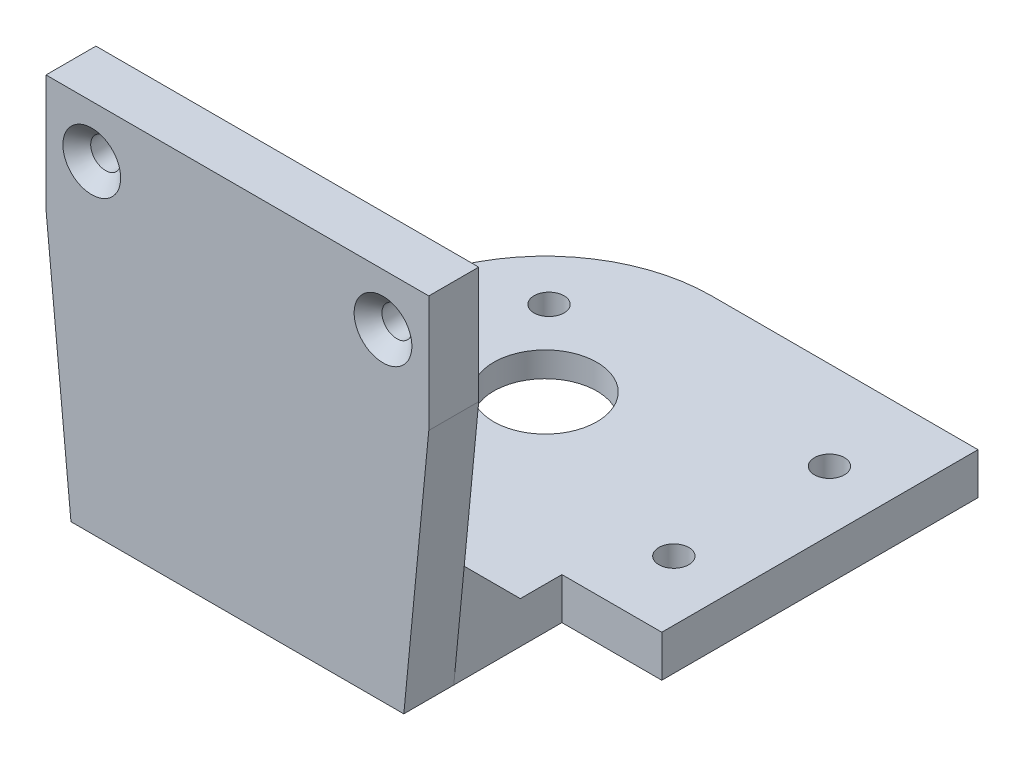
from build123d import *

# Parameters (mm, degrees)
SKETCH1_R                                            = 18
SKETCH1_R_2                                          = 6.2
BOSS_EXTRUDE1_DEPTH                                  = 3
BOSS_EXTRUDE2_START                                  = -5
SKETCH5_R                                            = 20
SKETCH5_R_2                                          = 18
BOSS_EXTRUDE2_DEPTH                                  = 5
BOSS_EXTRUDE3_START                                  = -5
BOSS_EXTRUDE3_DEPTH                                  = 5
SKETCH7_W                                            = 40
SKETCH7_H                                            = 45
BOSS_EXTRUDE4_DEPTH                                  = 6
SKETCH8_W                                            = 46
SKETCH8_H                                            = 14
BOSS_EXTRUDE5_DEPTH                                  = 6
BOSS_EXTRUDE6_DEPTH                                  = 6
CHAMFER1_SIZE                                        = 8
CSK_FOR_M3_HEX_SOCKET_COUNTERSUNK_HEAD_S_D           = 3.6
CSK_FOR_M3_HEX_SOCKET_COUNTERSUNK_HEAD_S_CSINK_D     = 6.94
CSK_FOR_M3_HEX_SOCKET_COUNTERSUNK_HEAD_S_CSINK_ANGLE = 90
BOSS_EXTRUDE7_DEPTH                                  = 5
M3_CLEARANCE_HOLE3_D                                 = 3.6
SKETCH26_R                                           = 4.25
CUT_EXTRUDE3_DEPTH                                   = 2


with BuildPart() as part:
    # Sketch1 → Boss-Extrude1 (new body)
    with BuildSketch(Plane(origin=(0, 0, 0), x_dir=(1, 0, 0), z_dir=(0, 1, 0))):
        with Locations(Location((0, 0, 0), (0, 0, 270))):
            Circle(SKETCH1_R)
        with Locations(Location((0, 0, 0), (0, 0, 270))):
            Circle(SKETCH1_R_2, mode=Mode.SUBTRACT)
    extrude(amount=BOSS_EXTRUDE1_DEPTH)

    # Sketch5 → Boss-Extrude2 (add)
    with BuildSketch(Plane(origin=(0, 3, 0), x_dir=(1, 0, 0), z_dir=(0, 1, 0)).offset(BOSS_EXTRUDE2_START)):
        with Locations(Location((0, 0, 0), (0, 0, 270))):
            Circle(SKETCH5_R)
        with Locations(Location((0, 0, 0), (0, 0, 270))):
            Circle(SKETCH5_R_2, mode=Mode.SUBTRACT)
    extrude(amount=BOSS_EXTRUDE2_DEPTH)

    # Sketch6 → Boss-Extrude3 (add)
    with BuildSketch(Plane(origin=(0, 3, 0), x_dir=(1, 0, 0), z_dir=(0, 1, 0)).offset(BOSS_EXTRUDE3_START)):
        with BuildLine():
            Line((-20, 0), (-20, -31))
            Line((-20, -31), (20, -31))
            Line((20, -31), (20, 0))
            ThreePointArc((20, 0), (0, -20), (-20, 0))
        make_face()
    extrude(amount=BOSS_EXTRUDE3_DEPTH)

    # Sketch7 → Boss-Extrude4 (add)
    with BuildSketch(Plane.XY.offset(31)):
        with Locations((0, 20.5)):
            Rectangle(SKETCH7_W, SKETCH7_H)
    extrude(amount=BOSS_EXTRUDE4_DEPTH)

    # Sketch8 → Boss-Extrude5 (add)
    with BuildSketch(Plane.XY.offset(37)):
        with Locations((0, 36)):
            Rectangle(SKETCH8_W, SKETCH8_H)
    extrude(amount=-BOSS_EXTRUDE5_DEPTH)

    # Sketch9 → Boss-Extrude6 (add)
    with BuildSketch(Plane.XY.offset(37)):
        Polygon((-23, 29), (-20, -2), (-20, 29), align=None)
        Polygon((20, -2), (23, 29), (20, 29), align=None)
    extrude(amount=-BOSS_EXTRUDE6_DEPTH)

    # Chamfer1
    chamfer1_edges = [part.edges().sort_by_distance(p)[0] for p in [
        (0, 3, 31),
    ]]
    chamfer(chamfer1_edges, length=CHAMFER1_SIZE)

    # CSK for M3 Hex Socket Countersunk Head Screw1 (through all)
    with Locations(Plane.XY.offset(37)):
        with Locations((17.5, 36.752814471), (-17.5, 36.752814471)):
            CounterSinkHole(CSK_FOR_M3_HEX_SOCKET_COUNTERSUNK_HEAD_S_D / 2, CSK_FOR_M3_HEX_SOCKET_COUNTERSUNK_HEAD_S_CSINK_D / 2, counter_sink_angle=CSK_FOR_M3_HEX_SOCKET_COUNTERSUNK_HEAD_S_CSINK_ANGLE)

    # Sketch23 → Boss-Extrude7 (add)
    with BuildSketch(Plane.XZ.offset(2)):
        with BuildLine():
            Line((0, -20), (32, -20))
            Line((32, -20), (32, 18))
            Line((32, 18), (20, 18))
            Line((20, 18), (20, 0))
            ThreePointArc((20, 0), (14.142135624, -14.142135624), (0, -20))
        make_face()
    extrude(amount=-BOSS_EXTRUDE7_DEPTH)

    # M3 Clearance Hole3 (through all)
    with Locations(Plane(origin=(0, -2, 0), x_dir=(-1, 0, 0), z_dir=(0, -1, 0))):
        with Locations((-24.8, 9.35), (8.9, 9.35), (8.9, -9.35), (-24.8, -9.35)):
            Hole(M3_CLEARANCE_HOLE3_D / 2)

    # Sketch26 → Cut-Extrude3 (cut)
    with BuildSketch(Plane.XZ.offset(2)):
        with Locations(Location((24.8, 9.35, 0), (0, 0, 270))):
            Circle(SKETCH26_R)
        with Locations(Location((24.8, -9.35, 0), (0, 0, 270))):
            Circle(SKETCH26_R)
    extrude(amount=-CUT_EXTRUDE3_DEPTH, mode=Mode.SUBTRACT)


solid = part.part
